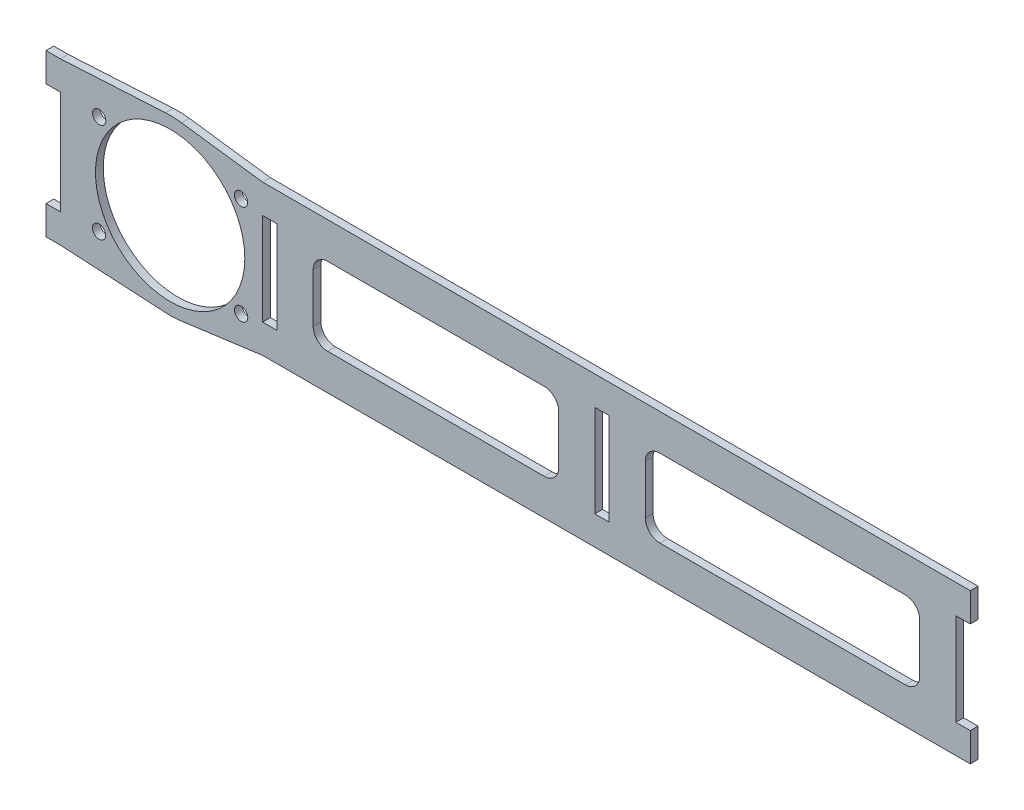
from build123d import *

# Parameters (mm, degrees)
SKETCH1_R           = 32.8295
SKETCH1_R_2         = 2.921000021
SKETCH1_W           = 6.35
SKETCH1_H           = 40.5892
BOSS_EXTRUDE1_DEPTH = 3.4036


with BuildPart() as part:
    # Sketch1 → Boss-Extrude1 (new body)
    with BuildSketch(Plane.XY):
        with BuildLine():
            Line((6310.72013516, 3386.676584946), (6310.72013516, 3341.108984946))
            Line((6310.72013516, 3341.108984946), (6304.37013516, 3341.108984946))
            Line((6304.37013516, 3341.108984946), (6304.37013516, 3328.408984946))
            Line((6304.37013516, 3328.408984946), (6310.72013516, 3328.408984946))
            Line((6310.72013516, 3328.408984946), (6356.849906468, 3325.851217453))
            ThreePointArc((6356.849906468, 3325.851217453), (6360.439847706, 3325.821566173), (6364.016642615, 3326.129941694))
            Line((6364.016642615, 3326.129941694), (6399.62013516, 3330.898184946))
            Line((6399.62013516, 3330.898184946), (6710.77013516, 3330.898184946))
            Line((6710.77013516, 3330.898184946), (6710.77013516, 3343.598184946))
            Line((6710.77013516, 3343.598184946), (6704.42013516, 3343.598184946))
            Line((6704.42013516, 3343.598184946), (6704.42013516, 3384.187384946))
            Line((6704.42013516, 3384.187384946), (6710.77013516, 3384.187384946))
            Line((6710.77013516, 3384.187384946), (6710.77013516, 3396.887384946))
            Line((6710.77013516, 3396.887384946), (6399.62013516, 3396.887384946))
            Line((6399.62013516, 3396.887384946), (6364.016642615, 3401.655628197))
            ThreePointArc((6364.016642615, 3401.655628197), (6360.439847706, 3401.964003719), (6356.849906468, 3401.934352439))
            Line((6356.849906468, 3401.934352439), (6310.72013516, 3399.376584946))
            Line((6310.72013516, 3399.376584946), (6304.37013516, 3399.376584946))
            Line((6304.37013516, 3399.376584946), (6304.37013516, 3386.676584946))
            Line((6304.37013516, 3386.676584946), (6310.72013516, 3386.676584946))
        make_face()
        with Locations((6358.95920556, 3363.892784946)):
            Circle(SKETCH1_R, mode=Mode.SUBTRACT)
        with Locations((6327.70875532, 3342.097845648)):
            Circle(SKETCH1_R_2, mode=Mode.SUBTRACT)
        with Locations((6390.168898653, 3342.039522577)):
            Circle(SKETCH1_R_2, mode=Mode.SUBTRACT)
        with Locations((6390.127285576, 3385.805356845)):
            Circle(SKETCH1_R_2, mode=Mode.SUBTRACT)
        with Locations((6327.749512467, 3385.746047315)):
            Circle(SKETCH1_R_2, mode=Mode.SUBTRACT)
        with Locations((6402.79513516, 3363.892784946)):
            Rectangle(SKETCH1_W, SKETCH1_H, mode=Mode.SUBTRACT)
        with BuildLine():
            Line((6421.84513516, 3353.123184946), (6421.84513516, 3374.662384946))
            ThreePointArc((6421.84513516, 3374.662384946), (6423.705007099, 3379.152513006), (6428.19513516, 3381.012384946))
            Line((6428.19513516, 3381.012384946), (6523.44513516, 3381.012384946))
            ThreePointArc((6523.44513516, 3381.012384946), (6527.93526322, 3379.152513006), (6529.79513516, 3374.662384946))
            Line((6529.79513516, 3374.662384946), (6529.79513516, 3353.123184946))
            ThreePointArc((6529.79513516, 3353.123184946), (6527.93526322, 3348.633056885), (6523.44513516, 3346.773184946))
            Line((6523.44513516, 3346.773184946), (6428.19513516, 3346.773184946))
            ThreePointArc((6428.19513516, 3346.773184946), (6423.705007099, 3348.633056885), (6421.84513516, 3353.123184946))
        make_face(mode=Mode.SUBTRACT)
        with BuildLine():
            Line((6682.19513516, 3381.012384946), (6574.24513516, 3381.012384946))
            ThreePointArc((6574.24513516, 3381.012384946), (6569.755007099, 3379.152513006), (6567.89513516, 3374.662384946))
            Line((6567.89513516, 3374.662384946), (6567.89513516, 3353.123184946))
            ThreePointArc((6567.89513516, 3353.123184946), (6569.755007099, 3348.633056885), (6574.24513516, 3346.773184946))
            Line((6574.24513516, 3346.773184946), (6682.19513516, 3346.773184946))
            ThreePointArc((6682.19513516, 3346.773184946), (6686.68526322, 3348.633056885), (6688.54513516, 3353.123184946))
            Line((6688.54513516, 3353.123184946), (6688.54513516, 3374.662384946))
            ThreePointArc((6688.54513516, 3374.662384946), (6686.68526322, 3379.152513006), (6682.19513516, 3381.012384946))
        make_face(mode=Mode.SUBTRACT)
        with Locations((6548.84513516, 3363.892784946)):
            Rectangle(SKETCH1_W, SKETCH1_H, mode=Mode.SUBTRACT)
    extrude(amount=BOSS_EXTRUDE1_DEPTH)


solid = part.part
